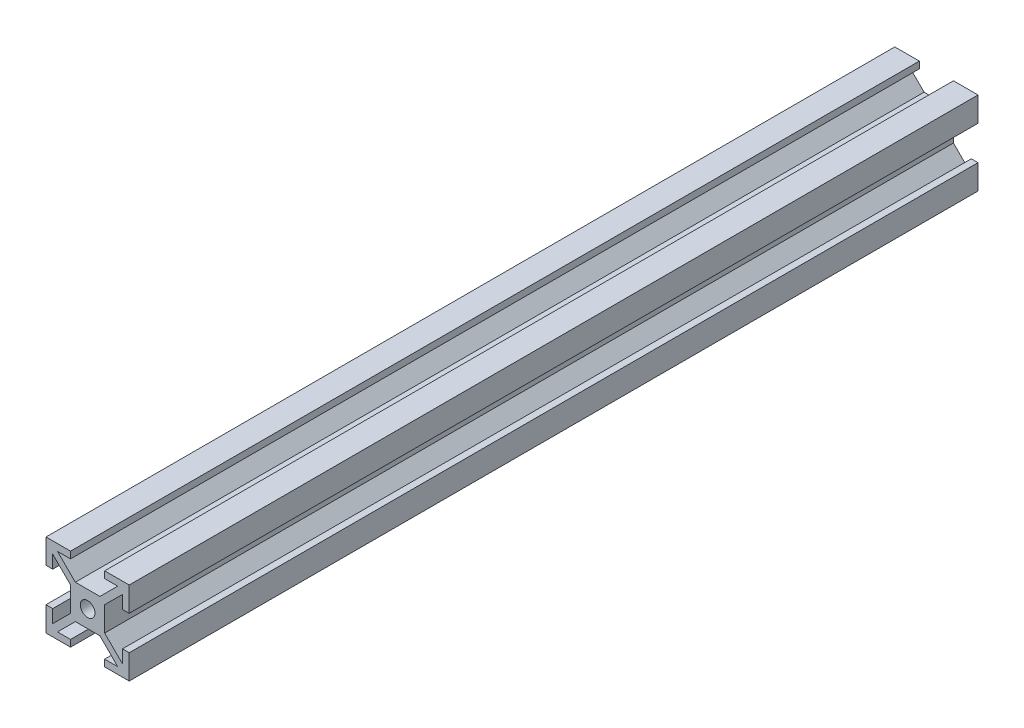
from build123d import *

# Parameters (mm, degrees)
SKETCH1_R           = 1.77
BOSS_EXTRUDE1_DEPTH = 204


with BuildPart() as part:
    # Sketch1 → Boss-Extrude1 (new body)
    with BuildSketch(Plane.XY):
        Polygon((-8.38, 4.1), (-10, 4.1), (-10, 10), (-4.1, 10), (-4.1, 8.38), (-7.234487014, 8.38), (-2.954487014, 4.1), (2.954487014, 4.1), (7.234487014, 8.38), (4.1, 8.38), (4.1, 10), (10, 10), (10, 4.1), (8.38, 4.1), (8.38, 7.234487014), (4.1, 2.954487014), (4.1, -2.954487014), (8.38, -7.234487014), (8.38, -4.1), (10, -4.1), (10, -10), (4.1, -10), (4.1, -8.38), (7.234487014, -8.38), (2.954487014, -4.1), (-2.954487014, -4.1), (-7.234487014, -8.38), (-4.1, -8.38), (-4.1, -10), (-10, -10), (-10, -4.1), (-8.38, -4.1), (-8.38, -7.234487014), (-4.1, -2.954487014), (-4.1, 2.954487014), (-8.38, 7.234487014), align=None)
        Circle(SKETCH1_R, mode=Mode.SUBTRACT)
    extrude(amount=BOSS_EXTRUDE1_DEPTH)


solid = part.part
